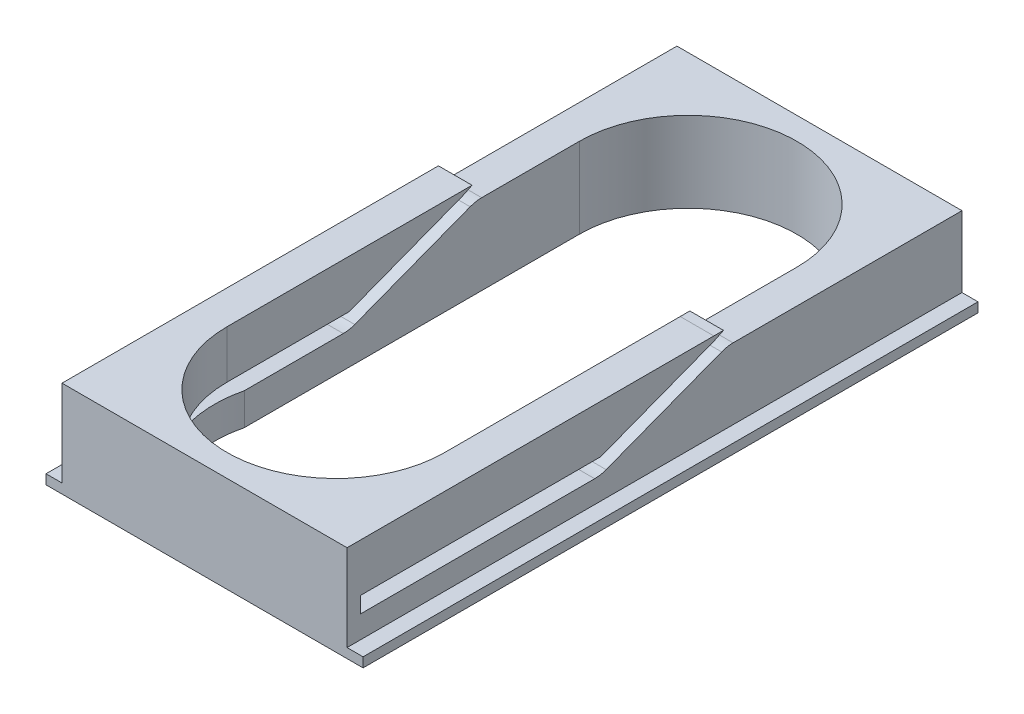
from build123d import *

# Parameters (mm, degrees)
SKETCH1_W            = 89
SKETCH1_H            = 192
BOSS_EXTRUDE1_DEPTH  = 30
SKETCH2_R            = 34.99943994
CUT_EXTRUDE1_DEPTH   = 10
SKETCH3_W            = 75
SKETCH3_H            = 5
CUT_EXTRUDE2_DEPTH   = 102
CUT_EXTRUDE4_DEPTH   = 102
SKETCH6_W            = 10.5
SKETCH6_H            = 4
CUT_EXTRUDE7_DEPTH   = 8
BOSS_EXTRUDE2_DEPTH  = 10.5
CUT_EXTRUDE8_DEPTH   = 20.767757578
BOSS_EXTRUDE3_DEPTH  = 10.5
CUT_EXTRUDE9_DEPTH   = 22.812544275
BOSS_EXTRUDE6_DEPTH  = 10.5
BOSS_EXTRUDE7_DEPTH  = 10.5
FILLET1_R            = 10
FILLET2_R            = 10
FILLET3_R            = 10
FILLET4_R            = 10
CUT_EXTRUDE11_DEPTH  = 99
SKETCH15_W           = 7.554212703
SKETCH15_H           = 3.259234926
CUT_EXTRUDE12_DEPTH  = 99
FILLET5_R            = 10
SKETCH16_W           = 4.893814379
SKETCH16_H           = 8
BOSS_EXTRUDE8_DEPTH  = 4
SKETCH17_R           = 2
CUT_EXTRUDE13_DEPTH  = 4
SKETCH18_W           = 192
SKETCH18_H           = 3
BOSS_EXTRUDE9_DEPTH  = 5
SKETCH19_W           = 192
SKETCH19_H           = 3
BOSS_EXTRUDE10_DEPTH = 5


with BuildPart() as part:
    # Sketch1 → Boss-Extrude1 (new body)
    with BuildSketch(Plane(origin=(0, 0, 0), x_dir=(1, 0, 0), z_dir=(0, 1, 0))):
        with Locations((-10.5, 20.043668932)):
            Rectangle(SKETCH1_W, SKETCH1_H)
        with BuildLine():
            Line((-44.5, -34.956331068), (-44.5, 75.043668932))
            ThreePointArc((-44.5, 75.043668932), (-10.5, 109.043668932), (23.5, 75.043668932))
            Line((23.5, 75.043668932), (23.5, -34.956331068))
            ThreePointArc((23.5, -34.956331068), (-10.5, -68.956331068), (-44.5, -34.956331068))
        make_face(mode=Mode.SUBTRACT)
    extrude(amount=BOSS_EXTRUDE1_DEPTH)

    # Sketch2 → Cut-Extrude1 (cut)
    with BuildSketch(Plane.XZ):
        with Locations((-10.5, 37.838844027)):
            Circle(SKETCH2_R)
    extrude(amount=-CUT_EXTRUDE1_DEPTH, mode=Mode.SUBTRACT)

    # Sketch3 → Cut-Extrude2 (cut)
    with BuildSketch(Plane(origin=(34, 0, 0), x_dir=(0, 0, -1), z_dir=(1, 0, 0))):
        with Locations((-34.286288065, 12.5)):
            Rectangle(SKETCH3_W, SKETCH3_H)
    extrude(amount=-CUT_EXTRUDE2_DEPTH, mode=Mode.SUBTRACT)

    # Sketch4 → Cut-Extrude4 (cut)
    with BuildSketch(Plane.ZY.offset(55)):
        Polygon((-40.970715348, 29.469395922), (-41.211628541, 24.561719678), (-3.213711935, 10), (-3.213711935, 15), align=None)
    extrude(amount=-CUT_EXTRUDE4_DEPTH, mode=Mode.SUBTRACT)

    # Sketch6 → Cut-Extrude7 (cut)
    with BuildSketch(Plane(origin=(0, 30, 0), x_dir=(1, 0, 0), z_dir=(0, 1, 0))):
        with Locations((-49.75, 40.570603007)):
            Rectangle(SKETCH6_W, SKETCH6_H)
        with Locations((28.75, 40.570603007)):
            Rectangle(SKETCH6_W, SKETCH6_H)
    extrude(amount=-CUT_EXTRUDE7_DEPTH, mode=Mode.SUBTRACT)

    # Sketch7 → Boss-Extrude2 (add)
    with BuildSketch(Plane.ZY.offset(55)):
        Polygon((-38.570603007, 23.549614886), (-42.570603007, 25.082511526), (-42.570603007, 22), (-38.570603007, 22), align=None)
    extrude(amount=-BOSS_EXTRUDE2_DEPTH)

    # Sketch8 → Cut-Extrude8 (cut)
    with BuildSketch(Plane.ZY.offset(55)):
        Polygon((-42.570603007, 25.082511526), (-55.402488324, 30), (-42.570603007, 30), align=None)
    extrude(amount=-CUT_EXTRUDE8_DEPTH, mode=Mode.SUBTRACT)

    # Sketch9 → Boss-Extrude3 (add)
    with BuildSketch(Plane(origin=(34, 0, 0), x_dir=(0, 0, -1), z_dir=(1, 0, 0))):
        Polygon((38.570603007, 23.549614886), (42.570603007, 25.082511526), (42.570603007, 22), (38.570603007, 22), align=None)
    extrude(amount=-BOSS_EXTRUDE3_DEPTH)

    # Sketch10 → Cut-Extrude9 (cut)
    with BuildSketch(Plane(origin=(34, 0, 0), x_dir=(0, 0, -1), z_dir=(1, 0, 0))):
        Polygon((42.570603007, 25.082511526), (55.402488324, 30), (42.570603007, 30), align=None)
    extrude(amount=-CUT_EXTRUDE9_DEPTH, mode=Mode.SUBTRACT)

    # Sketch12 → Boss-Extrude6 (add)
    with BuildSketch(Plane.ZY.offset(55)):
        Polygon((-38.570603007, 30), (-41.570603007, 30), (-38.570603007, 28.549614886), align=None)
    extrude(amount=-BOSS_EXTRUDE6_DEPTH)

    # Sketch11 → Boss-Extrude7 (add)
    with BuildSketch(Plane(origin=(34, 0, 0), x_dir=(0, 0, -1), z_dir=(1, 0, 0))):
        Polygon((38.570603007, 28.549614886), (41.570603007, 30.007074027), (38.570603007, 30), align=None)
    extrude(amount=-BOSS_EXTRUDE7_DEPTH)

    # Fillet1
    fillet1_edges = [part.edges().sort_by_distance(p)[0] for p in [
        (-49.75, 30, -55.402488324),
    ]]
    fillet(fillet1_edges, radius=FILLET1_R)

    # Fillet2
    fillet2_edges = [part.edges().sort_by_distance(p)[0] for p in [
        (28.75, 30, -55.402488324),
    ]]
    fillet(fillet2_edges, radius=FILLET2_R)

    # Fillet3
    fillet3_edges = [part.edges().sort_by_distance(p)[0] for p in [
        (-49.75, 10, -3.213711935),
    ]]
    fillet(fillet3_edges, radius=FILLET3_R)

    # Fillet4
    fillet4_edges = [part.edges().sort_by_distance(p)[0] for p in [
        (28.75, 10, -3.213711935),
    ]]
    fillet(fillet4_edges, radius=FILLET4_R)

    # Sketch14 → Cut-Extrude11 (cut)
    with BuildSketch(Plane(origin=(34, 0, 0), x_dir=(0, 0, -1), z_dir=(1, 0, 0))):
        Polygon((42.717415751, 25.138773717), (116.043668932, 25.138773717), (116.043668932, 30), (57.252994033, 30), (53.674522762, 29.337801849), align=None)
    extrude(amount=-CUT_EXTRUDE11_DEPTH, mode=Mode.SUBTRACT)


with BuildPart() as cut_extrude11_piece_1:
    # of the separate pieces the step leaves, piece 1, a body of its own (cut_extrude11_pieces)
    add(part.part.solids().sort_by_distance((23.5, 25.138773717, -42.717415751))[0])

    # Fillet5
    fillet5_edges = [cut_extrude11_piece_1.edges().sort_by_distance(p)[0] for p in [
        (-49.75, 25.138773717, -42.717415751),
        (28.75, 25.138773717, -42.717415751),
    ]]
    fillet(fillet5_edges, radius=FILLET5_R)

    # Sketch16 → Boss-Extrude8 (add)
    with BuildSketch(Plane(origin=(0, 0, 0), x_dir=(0, 0, -1), z_dir=(1, 0, 0))):
        with Locations((118.490576121, 11.138773717)):
            Rectangle(SKETCH16_W, SKETCH16_H)
    extrude(amount=BOSS_EXTRUDE8_DEPTH)

    # Sketch17 → Cut-Extrude13 (cut)
    with BuildSketch(Plane(origin=(4, 0, 0), x_dir=(0, 0, -1), z_dir=(1, 0, 0))):
        with Locations(Location((117.893374439, 11.138773717, 0), (0, 0, 202.353838102))):
            Circle(SKETCH17_R)
    extrude(amount=-CUT_EXTRUDE13_DEPTH, mode=Mode.SUBTRACT)

    # Sketch18 → Boss-Extrude9 (add)
    with BuildSketch(Plane(origin=(34, 0, 0), x_dir=(0, 0, -1), z_dir=(1, 0, 0))):
        with Locations((20.043668932, 1.5)):
            Rectangle(SKETCH18_W, SKETCH18_H)
    extrude(amount=BOSS_EXTRUDE9_DEPTH)

    # Sketch19 → Boss-Extrude10 (add)
    with BuildSketch(Plane.ZY.offset(55)):
        with Locations((-20.043668932, 1.5)):
            Rectangle(SKETCH19_W, SKETCH19_H)
    extrude(amount=BOSS_EXTRUDE10_DEPTH)


with BuildPart() as cut_extrude11_piece_2:
    # of the separate pieces the step leaves, piece 2, a body of its own (cut_extrude11_pieces)
    add(part.part.solids().sort_by_distance((23.5, 30, -57.252994033))[0])


with BuildPart() as cut_extrude11_piece_3:
    # of the separate pieces the step leaves, piece 3, a body of its own (cut_extrude11_pieces)
    add(part.part.solids().sort_by_distance((-55, 30, -57.252994033))[0])


with BuildPart() as cut_extrude12_tool:
    # Sketch15 → Cut-Extrude12 (new body)
    with BuildSketch(Plane(origin=(34, 0, 0), x_dir=(0, 0, -1), z_dir=(1, 0, 0))):
        with Locations((54.846987071, 29.864387296)):
            Rectangle(SKETCH15_W, SKETCH15_H)
    extrude(amount=-CUT_EXTRUDE12_DEPTH)


with BuildPart() as cut_extrude11_piece_2_1:
    add(cut_extrude11_piece_2.part)

    # Cut-Extrude12: cut by cut_extrude12_tool
    add(cut_extrude12_tool.part, mode=Mode.SUBTRACT)


with BuildPart() as cut_extrude11_piece_3_1:
    add(cut_extrude11_piece_3.part)

    # Cut-Extrude12: cut by cut_extrude12_tool
    add(cut_extrude12_tool.part, mode=Mode.SUBTRACT)


solid = cut_extrude11_piece_1.part
